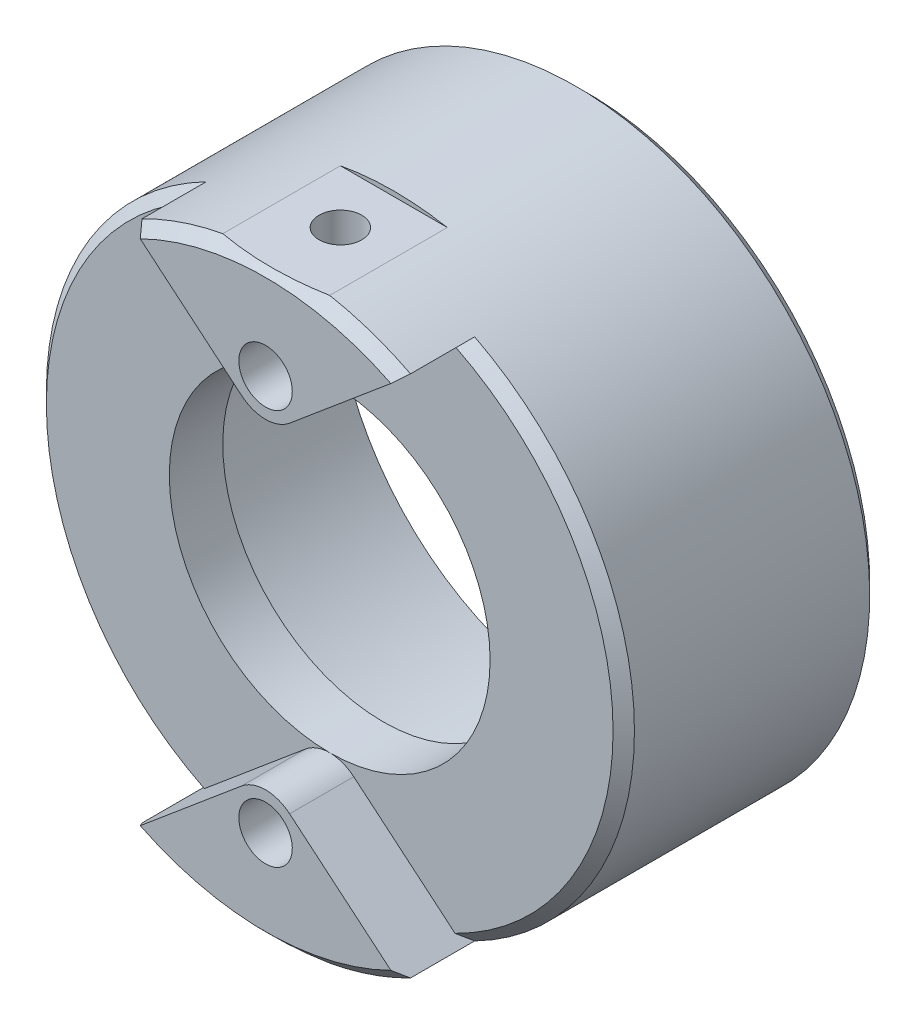
from build123d import *

# Parameters (mm, degrees)
CUT_EXTRUDE1_DEPTH = 6
SKETCH6_5_R        = 2.5
CUT_EXTRUDE4_DEPTH = 50.117206761
CHAMFER1_SIZE      = 1
SKETCH7_W          = 0.458365434
SKETCH7_H          = 10
CUT_EXTRUDE5_DEPTH = 12
SKETCH8_R          = 2
CUT_EXTRUDE6_DEPTH = 5


with BuildPart() as part:
    # Sketch4 → Revolve1 (revolve)
    with BuildSketch(Plane.YZ, mode=Mode.PRIVATE) as revolve1_sk:
        Polygon((27.5, 0), (27.5, 30), (15, 30), (15, 19), (23.5, 19), (23.5, 0), align=None)
    revolve(revolve1_sk.sketch.rotate(Axis((0, 0, 29.038216561), (0, 0, -1)), 180), axis=Axis((0, 0, 29.038216561), (0, 0, -1)))

    # Sketch6 → Cut-Extrude1 (cut)
    with BuildSketch(Plane(origin=(0, 0, 30), x_dir=(0, -1, 0), z_dir=(0, 0, 1))):
        with BuildLine():
            Line((24.466455653, -12.555578353), (15.818844449, -2.249756634))
            ThreePointArc((15.818844449, -2.249756634), (15.211075827, -1.197070502), (15, 0))
            ThreePointArc((15, 0), (-5e-09, -15), (-15, 1e-08))
            ThreePointArc((-15, 1e-08), (-15.211075826, -1.197070497), (-15.818844449, -2.249756634))
            Line((-15.818844449, -2.249756634), (-24.466455653, -12.555578353))
            ThreePointArc((-24.466455653, -12.555578353), (0, -27.5), (24.466455653, -12.555578353))
        make_face()
        with BuildLine():
            ThreePointArc((-15, 1e-08), (5e-09, 15), (15, 0))
            ThreePointArc((15, 0), (15.211075827, 1.197070502), (15.818844449, 2.249756634))
            Line((15.818844449, 2.249756634), (24.466455653, 12.555578353))
            ThreePointArc((24.466455653, 12.555578353), (0, 27.5), (-24.466455653, 12.555578353))
            Line((-24.466455653, 12.555578353), (-15.818844449, 2.249756634))
            ThreePointArc((-15.818844449, 2.249756634), (-15.211075829, 1.197070506), (-15, 1e-08))
        make_face()
    extrude(amount=-CUT_EXTRUDE1_DEPTH, mode=Mode.SUBTRACT)

    # Sketch6<5> → Cut-Extrude4 (cut, through all)
    with BuildSketch(Plane(origin=(0, 0, 30), x_dir=(0, -1, 0), z_dir=(0, 0, 1))):
        with Locations((18.5, 0)):
            Circle(SKETCH6_5_R)
        with Locations((-18.5, 0)):
            Circle(SKETCH6_5_R)
    extrude(amount=-CUT_EXTRUDE4_DEPTH, mode=Mode.SUBTRACT)

    # Chamfer1
    chamfer1_edges = [part.edges().sort_by_distance(p)[0] for p in [
        (-6.458423552, -26.730857922, 30),
        (-27.5, 0, 24),
        (0, 27.5, 30),
        (27.5, 0, 24),
        (0, 27.5, 0),
    ]]
    chamfer(chamfer1_edges, length=CHAMFER1_SIZE)

    # Sketch7 → Cut-Extrude5 (cut)
    with BuildSketch(Plane(origin=(0, 0, 30), x_dir=(0, -1, 0), z_dir=(0, 0, 1))):
        with Locations((-27.270817283, 0)):
            Rectangle(SKETCH7_W, SKETCH7_H)
        with Locations((27.270817283, 0)):
            Rectangle(SKETCH7_W, SKETCH7_H)
    extrude(amount=-CUT_EXTRUDE5_DEPTH, mode=Mode.SUBTRACT)

    # Sketch8 → Cut-Extrude6 (cut)
    with BuildSketch(Plane(origin=(0, 27.041634566, 0), x_dir=(-1, 0, 0), z_dir=(0, 1, 0))):
        with Locations(Location((0, 23, 0), (0, 0, 90))):
            Circle(SKETCH8_R)
    cut_extrude6 = extrude(amount=-CUT_EXTRUDE6_DEPTH, mode=Mode.SUBTRACT)

    # Mirror1: Cut-Extrude6 across plane
    add(cut_extrude6.mirror(Plane.ZX), mode=Mode.SUBTRACT)


solid = part.part
